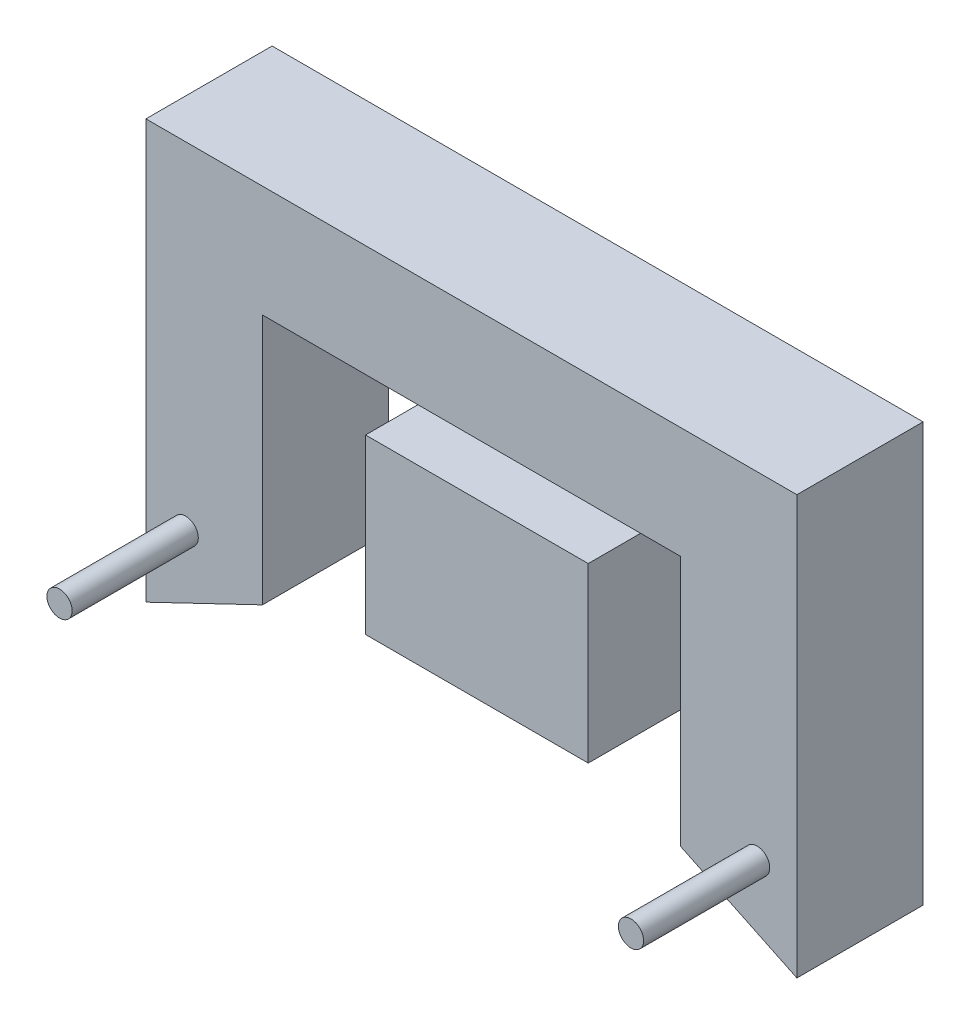
from build123d import *

# Parameters (mm, degrees)
SKETCH2_R            = 2
BOSS_EXTRUDE10_DEPTH = 20
SKETCH7_R            = 2
BOSS_EXTRUDE11_DEPTH = 20
SKETCH8_R            = 2
BOSS_EXTRUDE12_DEPTH = 20
SKETCH2_14_W         = 35.298621591
SKETCH2_14_H         = 27.393492294
BOSS_EXTRUDE13_DEPTH = 20


with BuildPart() as part:
    # Sketch2 → Boss-Extrude10 (new body)
    with BuildSketch(Plane.XY):
        Polygon((-185.692642178, -5.228439236), (-185.692642178, 61.118289384), (-82.501134399, 61.118289384), (-82.501134399, -5.228439236), (-100.974320011, 3.634455591), (-100.974320011, 43.432435389), (-167.219456565, 43.432435389), (-167.219456565, 3.634455591), align=None)
        with Locations((-179.389800335, 7.733691034)):
            Circle(SKETCH2_R, mode=Mode.SUBTRACT)
        with Locations((-88.803976242, 7.733691034)):
            Circle(SKETCH2_R, mode=Mode.SUBTRACT)
    extrude(amount=BOSS_EXTRUDE10_DEPTH)


with BuildPart() as body_2:
    # Sketch7 → Boss-Extrude11 (new body)
    with BuildSketch(Plane.XY.offset(20)):
        with Locations((-179.389800335, 7.733691034)):
            Circle(SKETCH7_R)
    extrude(amount=BOSS_EXTRUDE11_DEPTH)


with BuildPart() as body_3:
    # Sketch8 → Boss-Extrude12 (new body)
    with BuildSketch(Plane.XY.offset(20)):
        with Locations((-88.803976242, 7.733691034)):
            Circle(SKETCH8_R)
    extrude(amount=BOSS_EXTRUDE12_DEPTH)


with BuildPart() as body_4:
    # Sketch2<14> → Boss-Extrude13 (new body)
    with BuildSketch(Plane.XY):
        with Locations((-133.229015837, 21.430437181)):
            Rectangle(SKETCH2_14_W, SKETCH2_14_H)
    extrude(amount=BOSS_EXTRUDE13_DEPTH)


solid = Compound([part.part, body_2.part, body_3.part, body_4.part])
